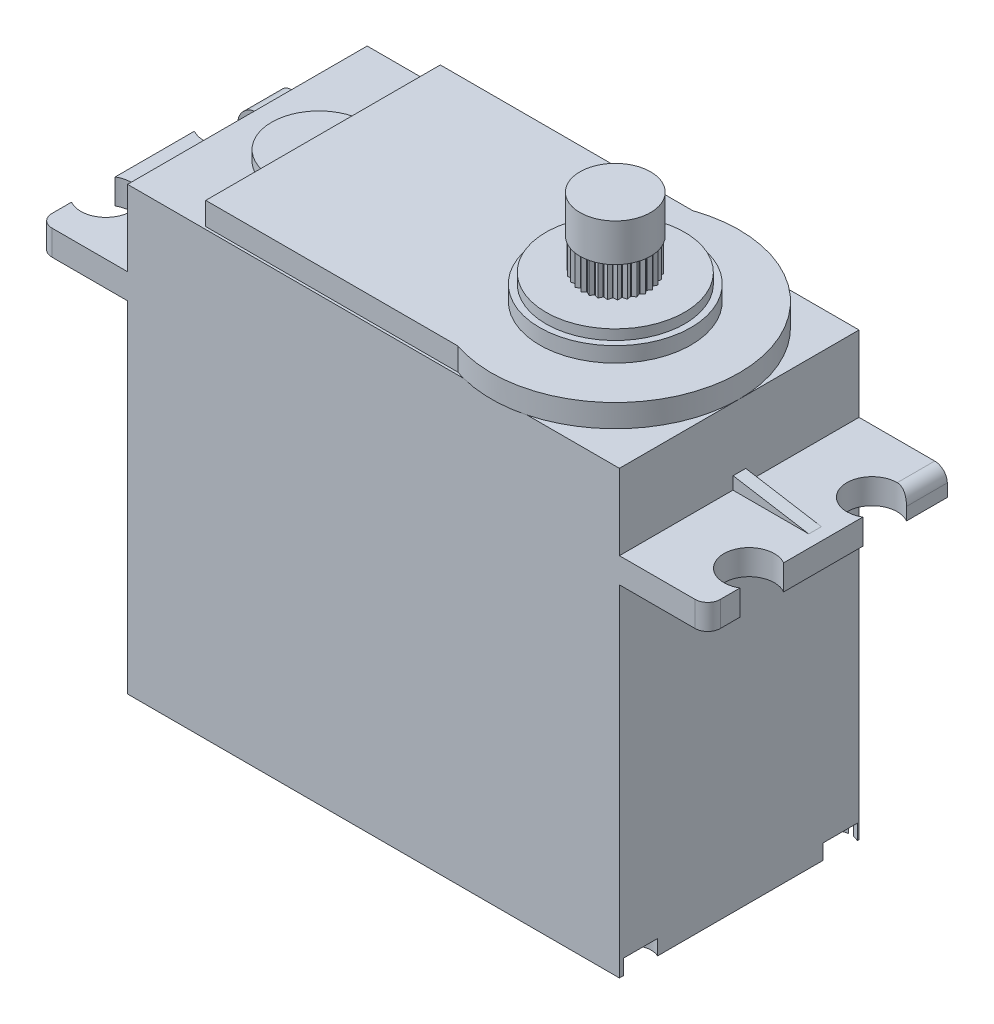
from build123d import *

# Parameters (mm, degrees)
SKETCH1_W            = 39
SKETCH1_H            = 35
BOSS_EXTRUDE1_DEPTH  = 19
SKETCH2_W            = 7
SKETCH2_H            = 2
BOSS_EXTRUDE2_DEPTH  = 19
BOSS_EXTRUDE3_DEPTH  = 0.5
SKETCH4_R            = 2
CUT_EXTRUDE1_DEPTH   = 3
FILLET1_R            = 1
BOSS_EXTRUDE4_DEPTH  = 1.8
SKETCH6_R            = 1.5
CUT_EXTRUDE2_DEPTH   = 1.2
SKETCH7_R            = 6
BOSS_EXTRUDE5_DEPTH  = 1.2
SKETCH8_R            = 5.5
BOSS_EXTRUDE6_DEPTH  = 0.8
BOSS_EXTRUDE7_DEPTH  = 0.8
SKETCH10_R           = 2.5
BOSS_EXTRUDE8_DEPTH  = 4
BOSS_EXTRUDE9_DEPTH  = 4
CIRPATTERN2_COUNT    = 30
SKETCH12_R           = 1.5
CUT_EXTRUDE4_DEPTH   = 4
SKETCH13_R           = 2.8
BOSS_EXTRUDE10_DEPTH = 1.5


with BuildPart() as part:
    # Sketch1 → Boss-Extrude1 (new body)
    with BuildSketch(Plane.XY):
        with Locations((-4.183412042, -9.229571984)):
            Rectangle(SKETCH1_W, SKETCH1_H)
    extrude(amount=BOSS_EXTRUDE1_DEPTH)

    # Sketch2 → Boss-Extrude2 (add)
    with BuildSketch(Plane.XY.offset(19)):
        with Locations((18.816587958, 1.270428016)):
            Rectangle(SKETCH2_W, SKETCH2_H)
        with Locations((-27.183412042, 1.270428016)):
            Rectangle(SKETCH2_W, SKETCH2_H)
    extrude(amount=-BOSS_EXTRUDE2_DEPTH)

    # Sketch3 → Boss-Extrude3 (add, symmetric)
    with BuildSketch(Plane.XY.offset(9.5)):
        Polygon((15.333582704, 3.272295291), (15.333582704, 2.272295291), (21.333582704, 2.272295291), align=None)
        Polygon((-29.666485395, 2.272295291), (-23.666485395, 3.272295291), (-23.666485395, 2.272295291), align=None)
    extrude(amount=BOSS_EXTRUDE3_DEPTH, both=True)


with BuildPart() as boss_extrude3_piece_1:
    # of the separate pieces the step leaves, piece 1, a body of its own (boss_extrude3_pieces)
    add(part.part.solids().sort_by_distance((-23.683412042, 8.270428016, 0))[0])

    # Sketch4 → Cut-Extrude1 (cut)
    with BuildSketch(Plane(origin=(0, 2.270428016, 0), x_dir=(1, 0, 0), z_dir=(0, 1, 0))):
        with Locations((21.316587958, -14.710690781)):
            Circle(SKETCH4_R)
        with Locations((21.316587958, -4.967002747)):
            Circle(SKETCH4_R)
        with Locations((-29.683412042, -14.710690781)):
            Circle(SKETCH4_R)
        with Locations((-29.683412042, -4.967002747)):
            Circle(SKETCH4_R)
    extrude(amount=-CUT_EXTRUDE1_DEPTH, mode=Mode.SUBTRACT)

    # Fillet1
    fillet1_edges = [boss_extrude3_piece_1.edges().sort_by_distance(p)[0] for p in [
        (-30.683412042, 1.270428016, 19),
        (-30.683412042, 2.270428016, 1.61747597),
        (22.316587958, 2.270428016, 1.61747597),
        (22.316587958, 1.270428016, 19),
    ]]
    fillet(fillet1_edges, radius=FILLET1_R)

    # Sketch5 → Boss-Extrude4 (add)
    with BuildSketch(Plane(origin=(0, 8.270428016, 0), x_dir=(1, 0, 0), z_dir=(0, 1, 0))):
        with BuildLine():
            Line((-17.683412042, -0.2), (-17.683412042, -18.8))
            Line((-17.683412042, -18.8), (2.316587958, -18.8))
            ThreePointArc((2.316587958, -18.8), (15.316587958, -9.5), (2.316587958, -0.2))
            Line((2.316587958, -0.2), (-17.683412042, -0.2))
        make_face()
    extrude(amount=BOSS_EXTRUDE4_DEPTH)

    # Sketch6 → Cut-Extrude2 (cut)
    with BuildSketch(Plane.XZ.offset(26.729571984)):
        with Locations((-22.660585011, 17.329722527)):
            Circle(SKETCH6_R)
        with Locations((-22.660585011, 1.487126069)):
            Circle(SKETCH6_R)
        with Locations((14.670467636, 17.329722527)):
            Circle(SKETCH6_R)
        with Locations((14.670467636, 1.487126069)):
            Circle(SKETCH6_R)
    extrude(amount=-CUT_EXTRUDE2_DEPTH, mode=Mode.SUBTRACT)

    # Sketch7 → Boss-Extrude5 (add)
    with BuildSketch(Plane(origin=(0, 10.070428016, 0), x_dir=(1, 0, 0), z_dir=(0, 1, 0))):
        with Locations(Location((5.490049496, -9.5, 0), (0, 0, 90))):
            Circle(SKETCH7_R)
    extrude(amount=BOSS_EXTRUDE5_DEPTH)

    # Sketch8 → Boss-Extrude6 (add)
    with BuildSketch(Plane(origin=(0, 11.270428016, 0), x_dir=(1, 0, 0), z_dir=(0, 1, 0))):
        with Locations(Location((5.490049496, -9.5, 0), (0, 0, 270))):
            Circle(SKETCH8_R)
    extrude(amount=BOSS_EXTRUDE6_DEPTH)

    # Sketch9 → Boss-Extrude7 (add)
    with BuildSketch(Plane(origin=(0, 8.270428016, 0), x_dir=(1, 0, 0), z_dir=(0, 1, 0))):
        with BuildLine():
            Line((-17.683412042, -6.065911172), (-17.683412042, -13.575118742))
            ThreePointArc((-17.683412042, -13.575118742), (-21.438015827, -9.820514957), (-17.683412042, -6.065911172))
        make_face()
    extrude(amount=BOSS_EXTRUDE7_DEPTH)

    # Sketch10 → Boss-Extrude8 (add)
    with BuildSketch(Plane(origin=(0, 12.070428016, 0), x_dir=(1, 0, 0), z_dir=(0, 1, 0))):
        with Locations(Location((5.490049496, -9.5, 0), (0, 0, 270))):
            Circle(SKETCH10_R)
    extrude(amount=BOSS_EXTRUDE8_DEPTH)

    # Sketch11 → Boss-Extrude9 (add)
    with BuildSketch(Plane(origin=(0, 16.070428016, 0), x_dir=(1, 0, 0), z_dir=(0, 1, 0))):
        Polygon((5.503448723, -6.801928291), (5.263137454, -7.010319112), (5.736737319, -7.012200748), align=None)
    boss_extrude9 = extrude(amount=-BOSS_EXTRUDE9_DEPTH)

    # CirPattern2: Boss-Extrude9 ×30 about axis
    cirpattern2_axis = Axis((5.490049496, 0, 9.5), (0, 1, 0))
    for i in range(1, CIRPATTERN2_COUNT):
        add(boss_extrude9.rotate(cirpattern2_axis, i * 360 / CIRPATTERN2_COUNT))

    # Sketch12 → Cut-Extrude4 (cut)
    with BuildSketch(Plane(origin=(0, 16.070428016, 0), x_dir=(1, 0, 0), z_dir=(0, 1, 0))):
        with Locations(Location((5.490049496, -9.5, 0), (0, 0, 270))):
            Circle(SKETCH12_R)
    extrude(amount=-CUT_EXTRUDE4_DEPTH, mode=Mode.SUBTRACT)

    # Sketch13 → Boss-Extrude10 (add, symmetric)
    with BuildSketch(Plane(origin=(0, 16.070428016, 0), x_dir=(1, 0, 0), z_dir=(0, 1, 0))):
        with Locations(Location((5.490049496, -9.5, 0), (0, 0, 270))):
            Circle(SKETCH13_R)
    extrude(amount=BOSS_EXTRUDE10_DEPTH, both=True)


with BuildPart() as boss_extrude3_piece_2:
    # of the separate pieces the step leaves, piece 2, a body of its own (boss_extrude3_pieces)
    add(part.part.solids().sort_by_distance((15.333582704, 3.272295291, 9))[0])


solid = Compound([boss_extrude3_piece_1.part, boss_extrude3_piece_2.part])
